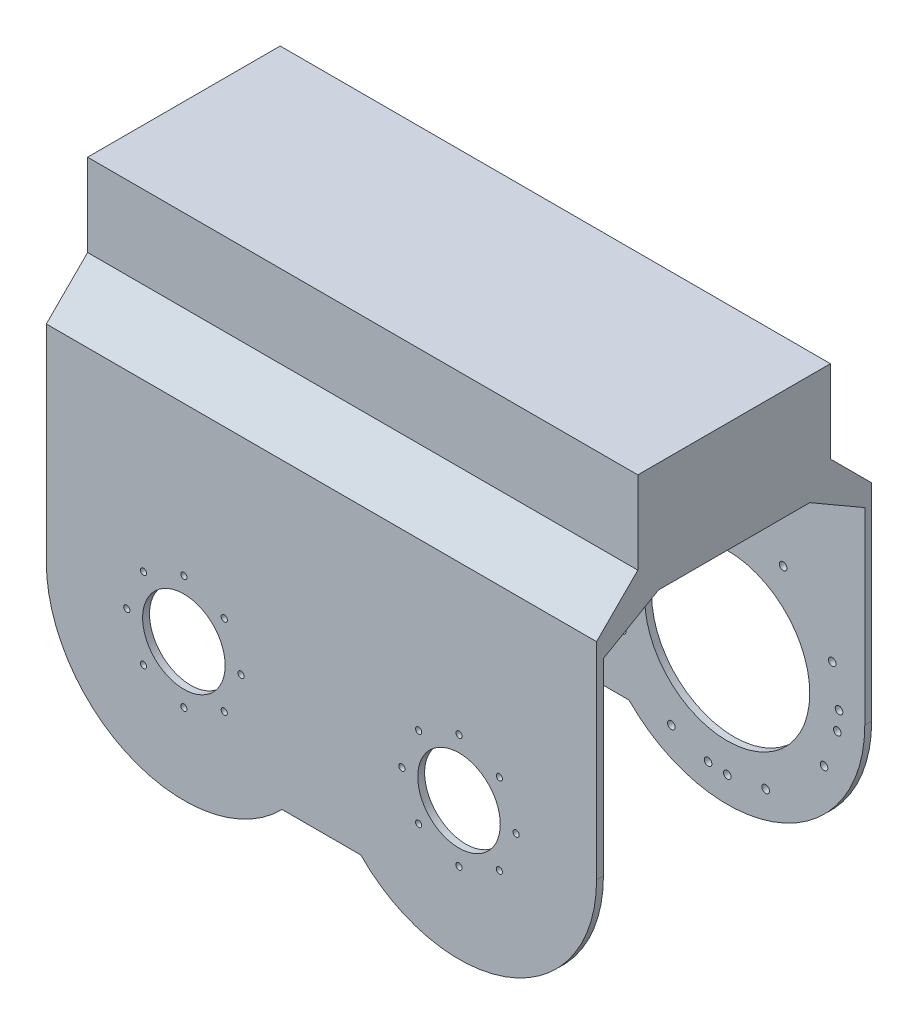
from build123d import *

# Parameters (mm, degrees)
SKETCH_1_R               = 60
EXTRUDE_1_DEPTH          = 200
CUT_EXTRUDE_1_DEPTH      = 371.94473982
CUT_EXTRUDE_1_DEPTH_BACK = 371.94473982
CUT_EXTRUDE_2_DEPTH      = 371.94473982
CUT_EXTRUDE_2_DEPTH_BACK = 371.94473982
SKETCH_4_R               = 2.75
CUT_EXTRUDE_3_DEPTH      = 32.5
EXTRUDE_START            = -5
SKETCH_5_R               = 60
SKETCH_5_R_2             = 30
EXTRUDE_2_DEPTH          = 5
SKETCH_6_R               = 2.25
CUT_EXTRUDE_4_DEPTH      = 5


with BuildPart() as part:
    # 草图1 → 凸台-拉伸1 (new body)
    with BuildSketch(Plane.XY):
        with BuildLine():
            Line((200, 180), (200, 0))
            ThreePointArc((200, 0), (137.805896177, -92.578151927), (28.585715715, -70))
            Line((28.585715715, -70), (-28.585715715, -70))
            ThreePointArc((-28.585715715, -70), (-137.805896177, -92.578151927), (-200, 0))
            Line((-200, 0), (-200, 180))
            Line((-200, 180), (-200, 240))
            Line((-200, 240), (200, 240))
            Line((200, 240), (200, 180))
        make_face()
        with Locations((100, 0)):
            Circle(SKETCH_1_R, mode=Mode.SUBTRACT)
        with Locations(Location((-100, 0, 0), (0, 0, 180))):
            Circle(SKETCH_1_R, mode=Mode.SUBTRACT)
    extrude(amount=EXTRUDE_1_DEPTH)

    # 草图2 → 切除-拉伸1 (cut, two sides: drawn at the far end of the back side and taken through both)
    with BuildSketch(Plane(origin=(0, 0, 0), x_dir=(0, 0, -1), z_dir=(1, 0, 0)).offset(-CUT_EXTRUDE_1_DEPTH_BACK)):
        Polygon((-195, 136.905989232), (-195, -163.094010768), (-5, -163.094010768), (-5, 136.905989232), (-45, 160), (-155, 160), align=None)
    extrude(amount=CUT_EXTRUDE_1_DEPTH + CUT_EXTRUDE_1_DEPTH_BACK, mode=Mode.SUBTRACT)

    # 草图3 → 切除-拉伸2 (cut, two sides: drawn at the far end of the back side and taken through both)
    with BuildSketch(Plane(origin=(0, 0, 0), x_dir=(0, 0, -1), z_dir=(1, 0, 0)).offset(-CUT_EXTRUDE_2_DEPTH_BACK)):
        Polygon((-170, 240), (-170, 180), (-200, 150), (-200, 240), align=None)
        Polygon((0, 240), (-30, 240), (-30, 180), (0, 150), align=None)
    extrude(amount=CUT_EXTRUDE_2_DEPTH + CUT_EXTRUDE_2_DEPTH_BACK, mode=Mode.SUBTRACT)

    # 草图4 → 切除-拉伸3 (cut)
    with BuildSketch(Plane(origin=(0, 0, 0), x_dir=(-1, 0, 0), z_dir=(0, 0, -1))):
        with Locations((-72.051017301, 76.291656595)):
            Circle(SKETCH_4_R)
        with Locations((-100, 81.25)):
            Circle(SKETCH_4_R)
        with Locations((-113.94129927, 80.045004058)):
            Circle(SKETCH_4_R)
        with Locations((-140.625, 70.364564057)):
            Circle(SKETCH_4_R)
        with Locations((-23.708343405, -27.948982699)):
            Circle(SKETCH_4_R)
        with Locations((-18.75, 0)):
            Circle(SKETCH_4_R)
        with Locations((-19.954995942, 13.94129927)):
            Circle(SKETCH_4_R)
        with Locations((-29.635435943, 40.625)):
            Circle(SKETCH_4_R)
        with Locations((-127.948982699, -76.291656595)):
            Circle(SKETCH_4_R)
        with Locations((-100, -81.25)):
            Circle(SKETCH_4_R)
        with Locations((-86.05870073, -80.045004058)):
            Circle(SKETCH_4_R)
        with Locations((-59.375, -70.364564057)):
            Circle(SKETCH_4_R)
        with Locations((-176.291656595, 27.948982699)):
            Circle(SKETCH_4_R)
        with Locations((-181.25, 0)):
            Circle(SKETCH_4_R)
        with Locations((-180.045004058, -13.94129927)):
            Circle(SKETCH_4_R)
        with Locations((-170.364564057, -40.625)):
            Circle(SKETCH_4_R)
        with Locations(Location((170.364564057, -40.625, 0), (0, 0, 90))):
            Circle(SKETCH_4_R)
        with Locations(Location((180.045004058, -13.94129927, 0), (0, 0, 90))):
            Circle(SKETCH_4_R)
        with Locations(Location((181.25, 0, 0), (0, 0, 90))):
            Circle(SKETCH_4_R)
        with Locations(Location((176.291656595, 27.948982699, 0), (0, 0, 90))):
            Circle(SKETCH_4_R)
        with Locations(Location((59.375, -70.364564057, 0), (0, 0, 90))):
            Circle(SKETCH_4_R)
        with Locations(Location((86.05870073, -80.045004058, 0), (0, 0, 90))):
            Circle(SKETCH_4_R)
        with Locations(Location((100, -81.25, 0), (0, 0, 90))):
            Circle(SKETCH_4_R)
        with Locations(Location((127.948982699, -76.291656595, 0), (0, 0, 90))):
            Circle(SKETCH_4_R)
        with Locations(Location((29.635435943, 40.625, 0), (0, 0, 90))):
            Circle(SKETCH_4_R)
        with Locations(Location((19.954995942, 13.94129927, 0), (0, 0, 90))):
            Circle(SKETCH_4_R)
        with Locations(Location((18.75, 0, 0), (0, 0, 90))):
            Circle(SKETCH_4_R)
        with Locations(Location((23.708343405, -27.948982699, 0), (0, 0, 90))):
            Circle(SKETCH_4_R)
        with Locations(Location((140.625, 70.364564057, 0), (0, 0, 90))):
            Circle(SKETCH_4_R)
        with Locations(Location((113.94129927, 80.045004058, 0), (0, 0, 90))):
            Circle(SKETCH_4_R)
        with Locations(Location((100, 81.25, 0), (0, 0, 90))):
            Circle(SKETCH_4_R)
        with Locations(Location((72.051017301, 76.291656595, 0), (0, 0, 90))):
            Circle(SKETCH_4_R)
    extrude(amount=-CUT_EXTRUDE_3_DEPTH, mode=Mode.SUBTRACT)

    # 草图5 → 凸台-拉伸2 (add)
    # profile 1 of 2: a face of its own
    with BuildSketch(Plane.XY.offset(200).offset(EXTRUDE_START)):
        with Locations(Location((-100, 0, 0), (0, 0, 180))):
            Circle(SKETCH_5_R)
        with Locations((-100, 0)):
            Circle(SKETCH_5_R_2, mode=Mode.SUBTRACT)
    # profile 2 of 2: a face of its own
    with BuildSketch(Plane.XY.offset(200).offset(EXTRUDE_START)):
        with Locations(Location((100, 0, 0), (0, 0, 90))):
            Circle(SKETCH_5_R)
        with Locations((100, 0)):
            Circle(SKETCH_5_R_2, mode=Mode.SUBTRACT)
    extrude(amount=EXTRUDE_2_DEPTH)

    # 草图6 → 切除-拉伸4 (cut)
    with BuildSketch(Plane.XY.offset(200)):
        with Locations((100, 41.5)):
            Circle(SKETCH_6_R)
        with Locations((129.344931419, 29.344931419)):
            Circle(SKETCH_6_R)
        with Locations((141.5, 0)):
            Circle(SKETCH_6_R)
        with Locations((129.344931419, -29.344931419)):
            Circle(SKETCH_6_R)
        with Locations((100, -41.5)):
            Circle(SKETCH_6_R)
        with Locations((70.655068581, -29.344931419)):
            Circle(SKETCH_6_R)
        with Locations((58.5, 0)):
            Circle(SKETCH_6_R)
        with Locations((70.655068581, 29.344931419)):
            Circle(SKETCH_6_R)
        with Locations(Location((-70.655068581, 29.344931419, 0), (0, 0, 270))):
            Circle(SKETCH_6_R)
        with Locations(Location((-58.5, 0, 0), (0, 0, 270))):
            Circle(SKETCH_6_R)
        with Locations(Location((-70.655068581, -29.344931419, 0), (0, 0, 270))):
            Circle(SKETCH_6_R)
        with Locations(Location((-100, -41.5, 0), (0, 0, 270))):
            Circle(SKETCH_6_R)
        with Locations(Location((-129.344931419, -29.344931419, 0), (0, 0, 270))):
            Circle(SKETCH_6_R)
        with Locations(Location((-141.5, 0, 0), (0, 0, 270))):
            Circle(SKETCH_6_R)
        with Locations(Location((-129.344931419, 29.344931419, 0), (0, 0, 270))):
            Circle(SKETCH_6_R)
        with Locations(Location((-100, 41.5, 0), (0, 0, 270))):
            Circle(SKETCH_6_R)
    extrude(amount=-CUT_EXTRUDE_4_DEPTH, mode=Mode.SUBTRACT)


solid = part.part
